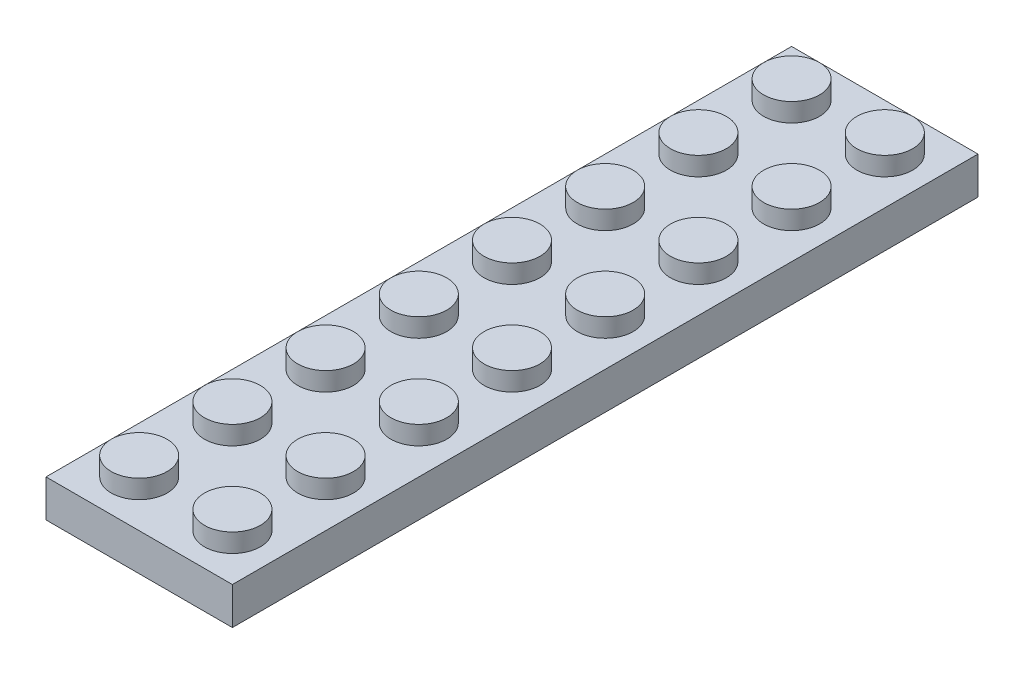
from build123d import *

# Parameters (mm, degrees)
SKETCH1_W            = 16
SKETCH1_H            = 64
BOSS_EXTRUDE1_DEPTH  = 3.2
SKETCH2_R            = 2.4
BOSS_EXTRUDE2_DEPTH  = 1.6
LPATTERN1_COUNT      = 2
LPATTERN1_PITCH      = 8
LPATTERN1_COUNT_DIR2 = 8
LPATTERN1_PITCH_DIR2 = 8
SHELL1_T             = -1.6


with BuildPart() as part:
    # Sketch1 → Boss-Extrude1 (new body)
    with BuildSketch(Plane(origin=(0, 0, 0), x_dir=(1, 0, 0), z_dir=(0, 1, 0))):
        with Locations((8, 32)):
            Rectangle(SKETCH1_W, SKETCH1_H)
    extrude(amount=BOSS_EXTRUDE1_DEPTH)

    # Sketch2 → Boss-Extrude2 (add)
    with BuildSketch(Plane(origin=(0, 3.2, 0), x_dir=(1, 0, 0), z_dir=(0, 1, 0))):
        with Locations(Location((12, 4, 0), (0, 0, 90))):
            Circle(SKETCH2_R)
    boss_extrude2 = extrude(amount=BOSS_EXTRUDE2_DEPTH)

    # LPattern1: Boss-Extrude2 2 × 8
    with Locations(*[(-i * LPATTERN1_PITCH, 0, -j * LPATTERN1_PITCH_DIR2) for i in range(LPATTERN1_COUNT) for j in range(LPATTERN1_COUNT_DIR2) if (i, j) != (0, 0)]):
        add(boss_extrude2)

    # Shell1
    shell1_openings = [part.faces().sort_by_distance(p)[0] for p in [
        (8, 0, -32),
    ]]
    offset(amount=SHELL1_T, openings=shell1_openings, kind=Kind.INTERSECTION)


solid = part.part
